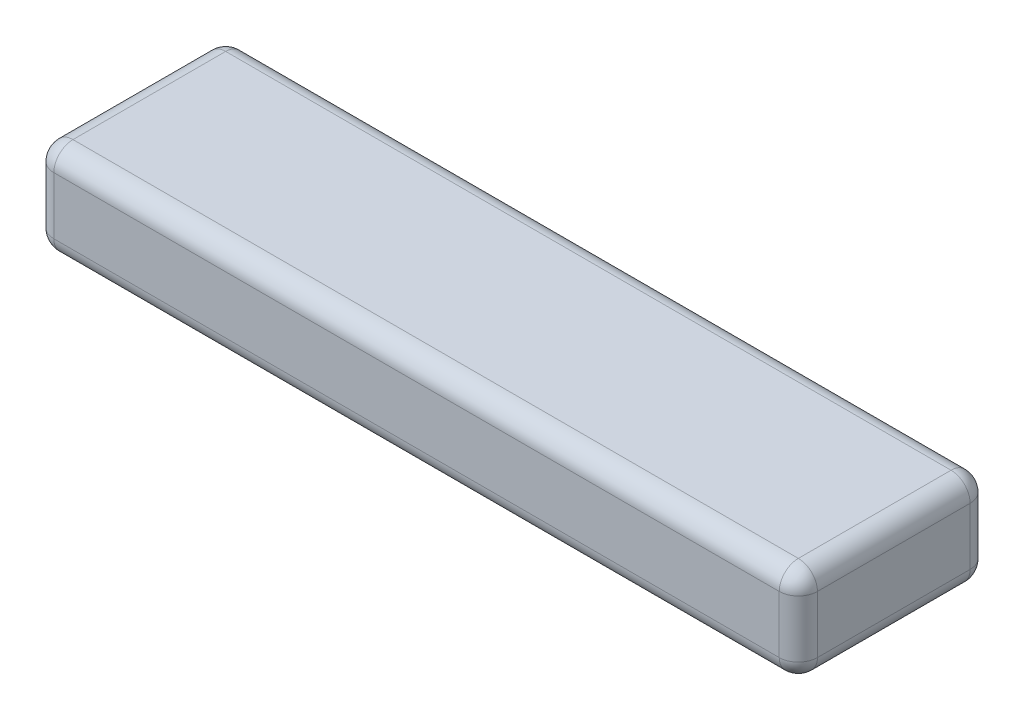
from build123d import *

# Parameters (mm, degrees)
SKETCH1_W           = 40
SKETCH1_H           = 10
BOSS_EXTRUDE1_DEPTH = 5
FILLET1_R           = 1


with BuildPart() as part:
    # Sketch1 → Boss-Extrude1 (new body)
    with BuildSketch(Plane(origin=(0, 0, 0), x_dir=(1, 0, 0), z_dir=(0, 1, 0))):
        Rectangle(SKETCH1_W, SKETCH1_H)
    extrude(amount=BOSS_EXTRUDE1_DEPTH)

    # Fillet1
    fillet1_edges = [part.edges().sort_by_distance(p)[0] for p in [
        (-20, 5, 0),
        (0, 5, 5),
        (20, 5, 0),
        (0, 0, 5),
        (-20, 0, 0),
        (0, 0, -5),
        (20, 0, 0),
        (20, 2.5, 5),
        (-20, 2.5, 5),
        (-20, 2.5, -5),
        (20, 2.5, -5),
        (0, 5, -5),
    ]]
    fillet(fillet1_edges, radius=FILLET1_R)


solid = part.part
